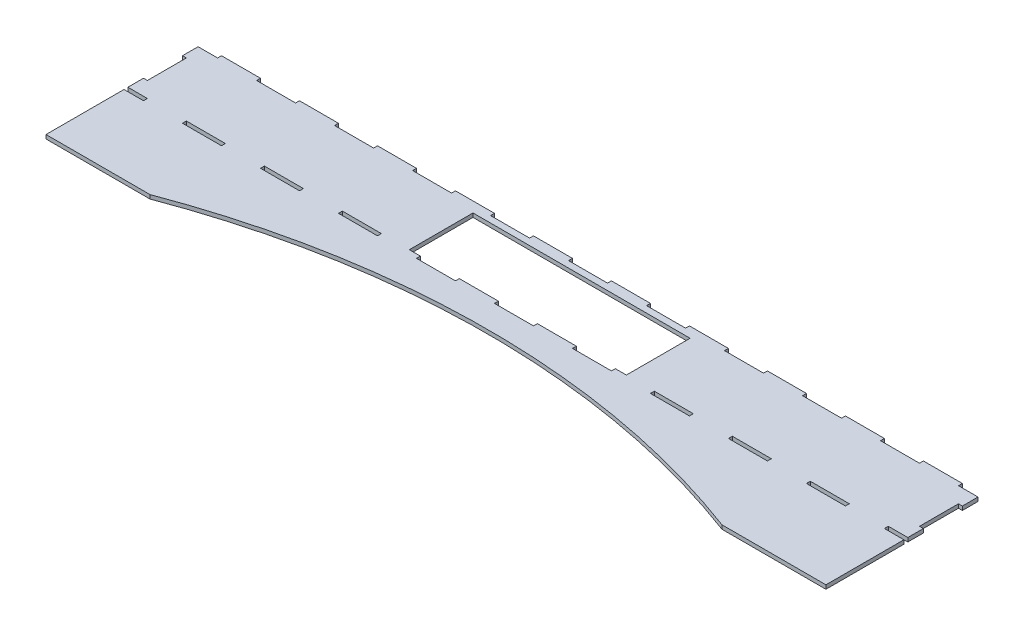
from build123d import *

# Parameters (mm, degrees)
SKETCH1_W           = 600
SKETCH1_H           = 60
BOSS_EXTRUDE1_DEPTH = 3
SKETCH4_W           = 600
SKETCH4_H           = 60
BOSS_EXTRUDE4_DEPTH = 3
SKETCH2_W           = 30
SKETCH2_H           = 3
SKETCH2_W_2         = 3
SKETCH2_H_2         = 30
CUT_EXTRUDE1_DEPTH  = 5
SKETCH5_W           = 167
SKETCH5_H           = 49
CUT_EXTRUDE2_DEPTH  = 5
CUT_EXTRUDE3_DEPTH  = 5


with BuildPart() as part:
    # Sketch1 → Boss-Extrude1 (new body)
    with BuildSketch(Plane(origin=(0, 0, 0), x_dir=(1, 0, 0), z_dir=(0, 1, 0))):
        with Locations((300, 30)):
            Rectangle(SKETCH1_W, SKETCH1_H)
    extrude(amount=BOSS_EXTRUDE1_DEPTH)

    # Sketch4 → Boss-Extrude4 (add)
    with BuildSketch(Plane(origin=(0, 3, 0), x_dir=(1, 0, 0), z_dir=(0, 1, 0))):
        with Locations((300, -30)):
            Rectangle(SKETCH4_W, SKETCH4_H)
    extrude(amount=-BOSS_EXTRUDE4_DEPTH)

    # Sketch2 → Cut-Extrude1 (cut)
    with BuildSketch(Plane(origin=(0, 3, 0), x_dir=(1, 0, 0), z_dir=(0, 1, 0))):
        with Locations((0, 1.5)):
            Rectangle(SKETCH2_W, SKETCH2_H)
        with Locations((60, 1.5)):
            Rectangle(SKETCH2_W, SKETCH2_H)
        with Locations((120, 1.5)):
            Rectangle(SKETCH2_W, SKETCH2_H)
        with Locations((180, 1.5)):
            Rectangle(SKETCH2_W, SKETCH2_H)
        with Locations((240, 1.5)):
            Rectangle(SKETCH2_W, SKETCH2_H)
        with Locations((300, 1.5)):
            Rectangle(SKETCH2_W, SKETCH2_H)
        with Locations((360, 1.5)):
            Rectangle(SKETCH2_W, SKETCH2_H)
        with Locations((420, 1.5)):
            Rectangle(SKETCH2_W, SKETCH2_H)
        with Locations((480, 1.5)):
            Rectangle(SKETCH2_W, SKETCH2_H)
        with Locations((540, 1.5)):
            Rectangle(SKETCH2_W, SKETCH2_H)
        with Locations((598.5, 30)):
            Rectangle(SKETCH2_W_2, SKETCH2_H_2)
        with Locations((540, 58.5)):
            Rectangle(SKETCH2_W, SKETCH2_H)
        with Locations((480, 58.5)):
            Rectangle(SKETCH2_W, SKETCH2_H)
        with Locations((420, 58.5)):
            Rectangle(SKETCH2_W, SKETCH2_H)
        with Locations((360, 58.5)):
            Rectangle(SKETCH2_W, SKETCH2_H)
        with Locations((300, 58.5)):
            Rectangle(SKETCH2_W, SKETCH2_H)
        with Locations((240, 58.5)):
            Rectangle(SKETCH2_W, SKETCH2_H)
        with Locations((180, 58.5)):
            Rectangle(SKETCH2_W, SKETCH2_H)
        with Locations((120, 58.5)):
            Rectangle(SKETCH2_W, SKETCH2_H)
        with Locations((60, 58.5)):
            Rectangle(SKETCH2_W, SKETCH2_H)
        with Locations((0, 58.5)):
            Rectangle(SKETCH2_W, SKETCH2_H)
        with Locations((1.5, 30)):
            Rectangle(SKETCH2_W_2, SKETCH2_H_2)
        with Locations((600, 1.5)):
            Rectangle(SKETCH2_W, SKETCH2_H)
        with Locations((600, 58.5)):
            Rectangle(SKETCH2_W, SKETCH2_H)
    extrude(amount=-CUT_EXTRUDE1_DEPTH, mode=Mode.SUBTRACT)

    # Sketch5 → Cut-Extrude2 (cut)
    with BuildSketch(Plane(origin=(0, 3, 0), x_dir=(1, 0, 0), z_dir=(0, 1, 0))):
        with Locations((300, 27.5)):
            Rectangle(SKETCH5_W, SKETCH5_H)
    extrude(amount=-CUT_EXTRUDE2_DEPTH, mode=Mode.SUBTRACT)

    # Sketch6 → Cut-Extrude3 (cut)
    with BuildSketch(Plane(origin=(0, 3, 0), x_dir=(1, 0, 0), z_dir=(0, 1, 0))):
        with BuildLine():
            Line((80, -60), (520, -60))
            ThreePointArc((520, -60), (300, -20), (80, -60))
        make_face()
    extrude(amount=-CUT_EXTRUDE3_DEPTH, mode=Mode.SUBTRACT)


solid = part.part
